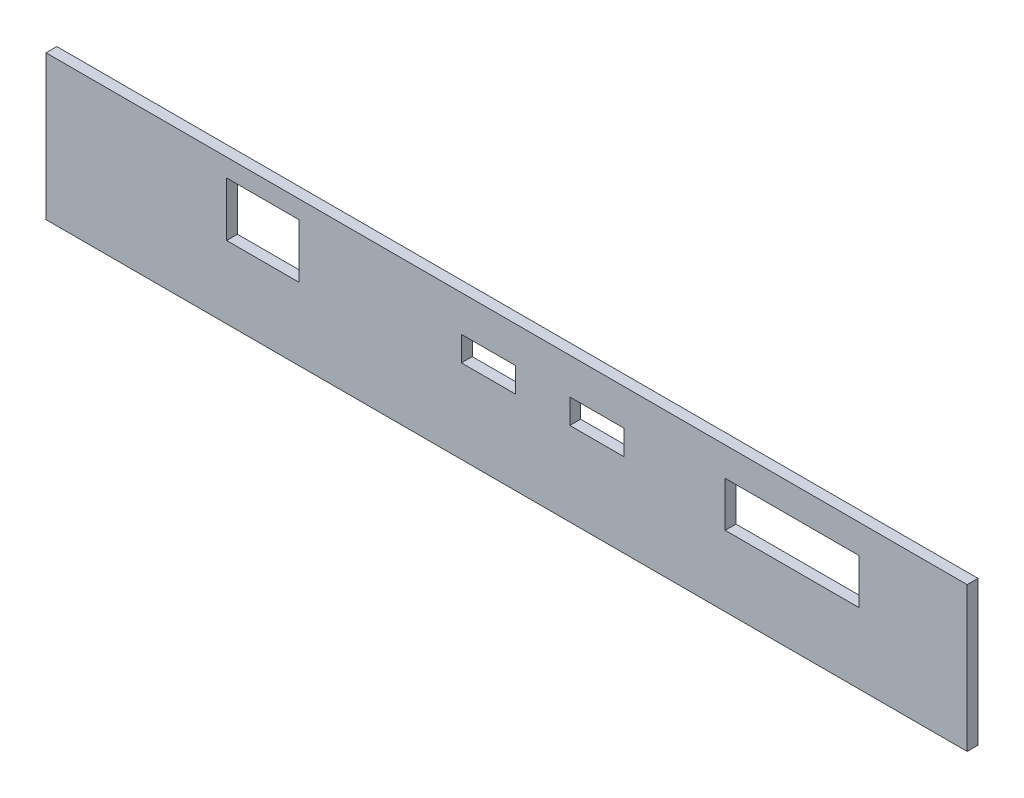
from build123d import *

# Parameters (mm, degrees)
SKETCH1_W           = 255
SKETCH1_H           = 40
SKETCH1_W_2         = 37
SKETCH1_H_2         = 12.479370463
SKETCH1_W_3         = 15
SKETCH1_H_3         = 6.838113775
SKETCH1_W_4         = 20
SKETCH1_H_4         = 15
BOSS_EXTRUDE1_DEPTH = 3


with BuildPart() as part:
    # Sketch1 → Boss-Extrude1 (new body)
    with BuildSketch(Plane.XY):
        with Locations((5.228376866, -5.353159851)):
            Rectangle(SKETCH1_W, SKETCH1_H)
        with Locations((84.228376866, 0.407154917)):
            Rectangle(SKETCH1_W_2, SKETCH1_H_2, mode=Mode.SUBTRACT)
        with Locations((30.228376866, 1.227783261)):
            Rectangle(SKETCH1_W_3, SKETCH1_H_3, mode=Mode.SUBTRACT)
        with Locations((0.228376866, 1.227783261)):
            Rectangle(SKETCH1_W_3, SKETCH1_H_3, mode=Mode.SUBTRACT)
        with Locations((-62.271623134, 2.146840149)):
            Rectangle(SKETCH1_W_4, SKETCH1_H_4, mode=Mode.SUBTRACT)
    extrude(amount=BOSS_EXTRUDE1_DEPTH)


solid = part.part
